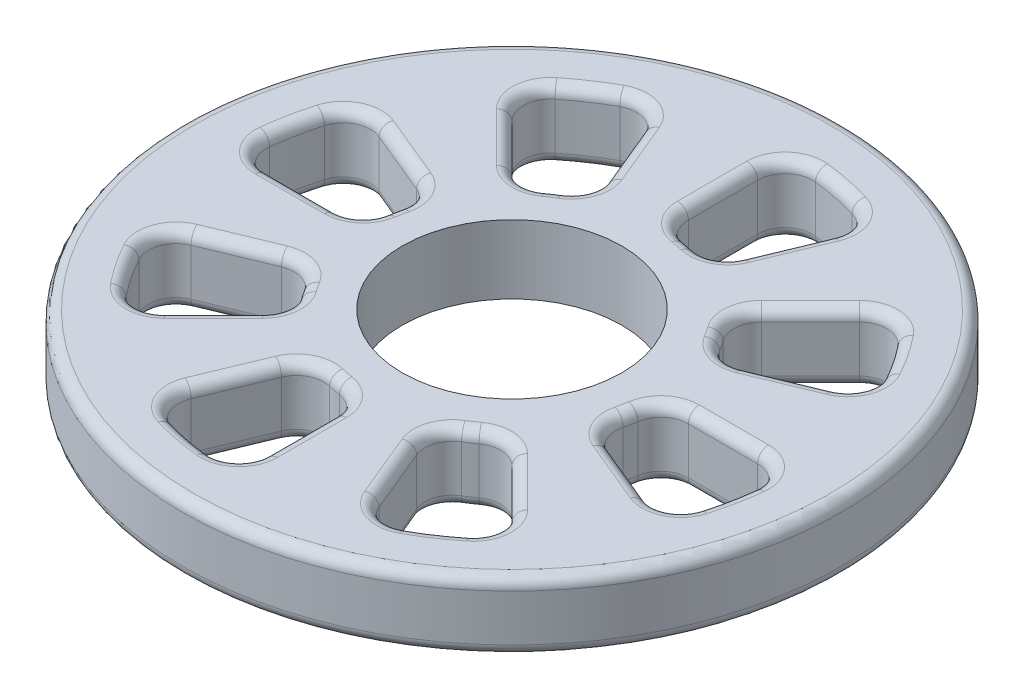
from build123d import *

# Parameters (mm, degrees)
SKETCH1_R           = 24
SKETCH1_R_2         = 8
BOSS_EXTRUDE1_DEPTH = 5
FILLET1_R           = 2
FILLET2_R           = 0.8
FILLET3_R           = 0.8


with BuildPart() as part:
    # Sketch1 → Boss-Extrude1 (new body)
    with BuildSketch(Plane(origin=(0, 0, 0), x_dir=(1, 0, 0), z_dir=(0, 1, 0))):
        with Locations(Location((0, 0, 0), (0, 0, 270))):
            Circle(SKETCH1_R)
        with Locations(Location((0, 0, 0), (0, 0, 270))):
            Circle(SKETCH1_R_2, mode=Mode.SUBTRACT)
        with BuildLine():
            Line((0, 11), (0, 20))
            ThreePointArc((0, 20), (3.90180644, 19.615705608), (7.653668647, 18.47759065))
            Line((7.653668647, 18.47759065), (4.209517756, 10.162674858))
            ThreePointArc((4.209517756, 10.162674858), (2.145993542, 10.788638084), (0, 11))
        make_face(mode=Mode.SUBTRACT)
        with BuildLine():
            Line((7.778174593, 7.778174593), (14.142135624, 14.142135624))
            ThreePointArc((14.142135624, 14.142135624), (16.629392246, 11.11140466), (18.47759065, 7.653668647))
            Line((18.47759065, 7.653668647), (10.162674858, 4.209517756))
            ThreePointArc((10.162674858, 4.209517756), (9.146165735, 6.111272563), (7.778174593, 7.778174593))
        make_face(mode=Mode.SUBTRACT)
        with BuildLine():
            Line((11, 0), (20, 0))
            ThreePointArc((20, 0), (19.615705608, -3.90180644), (18.47759065, -7.653668647))
            Line((18.47759065, -7.653668647), (10.162674858, -4.209517756))
            ThreePointArc((10.162674858, -4.209517756), (10.788638084, -2.145993542), (11, 0))
        make_face(mode=Mode.SUBTRACT)
        with BuildLine():
            Line((7.778174593, -7.778174593), (14.142135624, -14.142135624))
            ThreePointArc((14.142135624, -14.142135624), (11.11140466, -16.629392246), (7.653668647, -18.47759065))
            Line((7.653668647, -18.47759065), (4.209517756, -10.162674858))
            ThreePointArc((4.209517756, -10.162674858), (6.111272563, -9.146165735), (7.778174593, -7.778174593))
        make_face(mode=Mode.SUBTRACT)
        with BuildLine():
            Line((0, -11), (0, -20))
            ThreePointArc((0, -20), (-3.90180644, -19.615705608), (-7.653668647, -18.47759065))
            Line((-7.653668647, -18.47759065), (-4.209517756, -10.162674858))
            ThreePointArc((-4.209517756, -10.162674858), (-2.145993542, -10.788638084), (0, -11))
        make_face(mode=Mode.SUBTRACT)
        with BuildLine():
            Line((-7.778174593, -7.778174593), (-14.142135624, -14.142135624))
            ThreePointArc((-14.142135624, -14.142135624), (-16.629392246, -11.11140466), (-18.47759065, -7.653668647))
            Line((-18.47759065, -7.653668647), (-10.162674858, -4.209517756))
            ThreePointArc((-10.162674858, -4.209517756), (-9.146165735, -6.111272563), (-7.778174593, -7.778174593))
        make_face(mode=Mode.SUBTRACT)
        with BuildLine():
            Line((-11, 0), (-20, 0))
            ThreePointArc((-20, 0), (-19.615705608, 3.90180644), (-18.47759065, 7.653668647))
            Line((-18.47759065, 7.653668647), (-10.162674858, 4.209517756))
            ThreePointArc((-10.162674858, 4.209517756), (-10.788638084, 2.145993542), (-11, 0))
        make_face(mode=Mode.SUBTRACT)
        with BuildLine():
            Line((-7.778174593, 7.778174593), (-14.142135624, 14.142135624))
            ThreePointArc((-14.142135624, 14.142135624), (-11.11140466, 16.629392246), (-7.653668647, 18.47759065))
            Line((-7.653668647, 18.47759065), (-4.209517756, 10.162674858))
            ThreePointArc((-4.209517756, 10.162674858), (-6.111272563, 9.146165735), (-7.778174593, 7.778174593))
        make_face(mode=Mode.SUBTRACT)
    extrude(amount=BOSS_EXTRUDE1_DEPTH)

    # Fillet1
    fillet1_edges = [part.edges().sort_by_distance(p)[0] for p in [
        (-7.778174593, 2.5, -7.778174593),
        (-4.209517756, 2.5, -10.162674858),
        (-7.653668647, 2.5, -18.47759065),
        (-14.142135624, 2.5, -14.142135624),
        (0, 2.5, -11),
        (4.209517756, 2.5, -10.162674858),
        (7.653668647, 2.5, -18.47759065),
        (0, 2.5, -20),
        (7.778174593, 2.5, -7.778174593),
        (10.162674858, 2.5, -4.209517756),
        (18.47759065, 2.5, -7.653668647),
        (14.142135624, 2.5, -14.142135624),
        (11, 2.5, 0),
        (10.162674858, 2.5, 4.209517756),
        (18.47759065, 2.5, 7.653668647),
        (20, 2.5, 0),
        (7.778174593, 2.5, 7.778174593),
        (4.209517756, 2.5, 10.162674858),
        (7.653668647, 2.5, 18.47759065),
        (14.142135624, 2.5, 14.142135624),
        (0, 2.5, 11),
        (-4.209517756, 2.5, 10.162674858),
        (-7.653668647, 2.5, 18.47759065),
        (0, 2.5, 20),
        (-7.778174593, 2.5, 7.778174593),
        (-10.162674858, 2.5, 4.209517756),
        (-18.47759065, 2.5, 7.653668647),
        (-14.142135624, 2.5, 14.142135624),
        (-11, 2.5, 0),
        (-10.162674858, 2.5, -4.209517756),
        (-18.47759065, 2.5, -7.653668647),
        (-20, 2.5, 0),
    ]]
    fillet(fillet1_edges, radius=FILLET1_R)

    # Fillet2
    fillet2_edges = [part.edges().sort_by_distance(p)[0] for p in [
        (0, 0, -24),
        (0, 5, -24),
    ]]
    fillet(fillet2_edges, radius=FILLET2_R)

    # Fillet3
    fillet3_edges = [part.edges().sort_by_distance(p)[0] for p in [
        (-13.231798673, 0, -14.174607715),
        (-4.862114992, 0, -10.481555347),
        (-6.111272563, 0, -9.146165735),
        (-10.866030851, 0, -10.866030851),
        (-16.629392246, 0, 11.11140466),
        (-17.648975505, 0, 8.032039816),
        (-14.197153486, 0, 5.880653521),
        (-10.866030851, 0, 10.866030851),
        (8.032039816, 0, 17.648975505),
        (5.880653521, 0, 14.197153486),
        (6.111272563, 0, 9.146165735),
        (10.866030851, 0, 10.866030851),
        (17.648975505, 0, -8.032039816),
        (9.146165735, 0, -6.111272563),
        (8.503126103, 0, -7.8230436),
        (6.80020044, 0, -18.159220082),
        (3.973544381, 0, -10.849613345),
        (0.480890949, 0, -11.544345307),
        (0, 0, -15.366888199),
        (18.159220082, 0, 6.80020044),
        (14.197153486, 0, 5.880653521),
        (10.788638084, 0, 2.145993542),
        (-3.90180644, 0, 19.615705608),
        (-5.880653521, 0, 14.197153486),
        (-2.145993542, 0, 10.788638084),
        (-0.480890949, 0, 11.544345307),
        (0, 0, 15.366888199),
        (-19.379255805, 0, -0.666666667),
        (-19.615705608, 0, -3.90180644),
        (-18.159220082, 0, -6.80020044),
        (-11.544345307, 0, -0.480890949),
        (-15.366888199, 0, 0),
        (15.366888199, 0, 0),
        (-10.866030851, 5, -10.866030851),
        (-7.8230436, 5, -8.503126103),
        (-6.111272563, 5, -9.146165735),
        (-5.880653521, 5, -14.197153486),
        (-18.159220082, 5, -6.80020044),
        (-19.615705608, 5, -3.90180644),
        (-15.366888199, 5, 0),
        (-11.544345307, 5, -0.480890949),
        (-10.788638084, 5, -2.145993542),
        (-10.849613345, 5, -3.973544381),
        (-17.648975505, 5, 8.032039816),
        (-10.866030851, 5, 10.866030851),
        (-8.503126103, 5, 7.8230436),
        (-9.146165735, 5, 6.111272563),
        (-14.197153486, 5, 5.880653521),
        (-3.90180644, 5, 19.615705608),
        (0, 5, 15.366888199),
        (-0.480890949, 5, 11.544345307),
        (-3.973544381, 5, 10.849613345),
        (8.032039816, 5, 17.648975505),
        (11.11140466, 5, 16.629392246),
        (10.866030851, 5, 10.866030851),
        (6.111272563, 5, 9.146165735),
        (4.862114992, 5, 10.481555347),
        (5.880653521, 5, 14.197153486),
        (18.159220082, 5, 6.80020044),
        (19.615705608, 5, 3.90180644),
        (10.788638084, 5, 2.145993542),
        (17.648975505, 5, -8.032039816),
        (10.866030851, 5, -10.866030851),
        (8.503126103, 5, -7.8230436),
        (9.146165735, 5, -6.111272563),
        (10.481555347, 5, -4.862114992),
        (0, 5, -15.366888199),
        (0.480890949, 5, -11.544345307),
        (2.145993542, 5, -10.788638084),
        (3.973544381, 5, -10.849613345),
        (14.197153486, 5, -5.880653521),
    ]]
    fillet(fillet3_edges, radius=FILLET3_R)


solid = part.part
